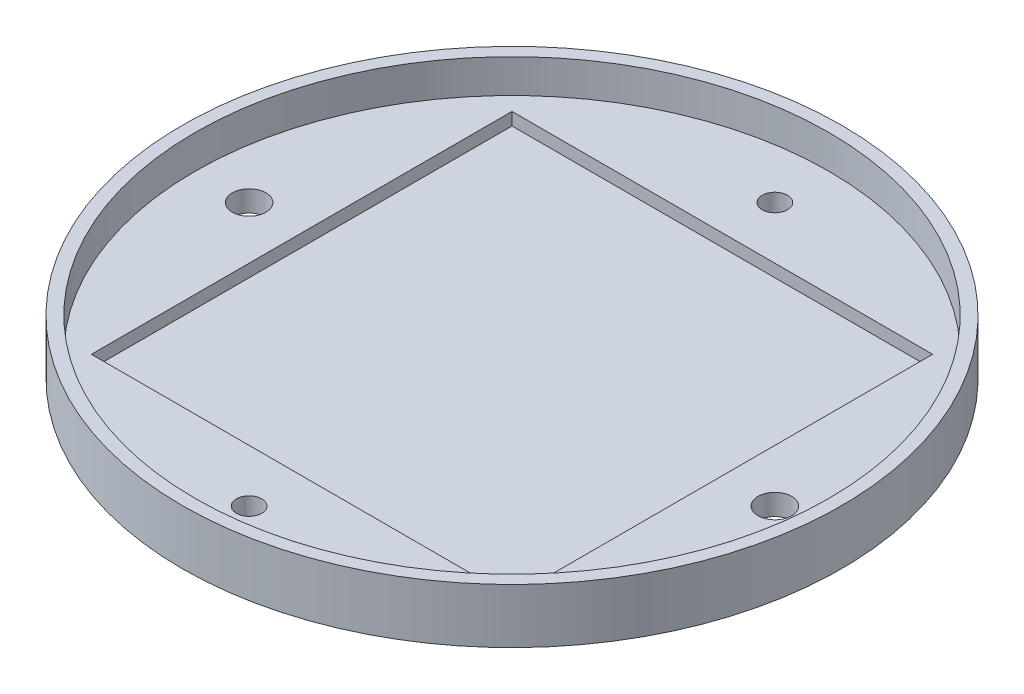
from build123d import *

# Parameters (mm, degrees)
SKETCH1_R           = 78.35
SKETCH1_R_2         = 4
SKETCH1_R_3         = 3
BOSS_EXTRUDE1_DEPTH = 5
SKETCH2_R           = 78.35
SKETCH2_R_2         = 75.35
BOSS_EXTRUDE2_DEPTH = 8
SKETCH3_W           = 100
SKETCH3_H           = 100
CUT_EXTRUDE1_DEPTH  = 3


with BuildPart() as part:
    # Sketch1 → Boss-Extrude1 (new body)
    with BuildSketch(Plane(origin=(0, 0, 0), x_dir=(1, 0, 0), z_dir=(0, 1, 0))):
        with Locations(Location((0, 0, 0), (0, 0, 270))):
            Circle(SKETCH1_R)
        with Locations(Location((-62.5, 0, 0), (0, 0, 270))):
            Circle(SKETCH1_R_2, mode=Mode.SUBTRACT)
        with Locations(Location((62.5, 0, 0), (0, 0, 270))):
            Circle(SKETCH1_R_2, mode=Mode.SUBTRACT)
        with Locations(Location((0, 62.5, 0), (0, 0, 270))):
            Circle(SKETCH1_R_3, mode=Mode.SUBTRACT)
        with Locations(Location((0, -62.5, 0), (0, 0, 270))):
            Circle(SKETCH1_R_3, mode=Mode.SUBTRACT)
    extrude(amount=BOSS_EXTRUDE1_DEPTH)

    # Sketch2 → Boss-Extrude2 (add)
    with BuildSketch(Plane(origin=(0, 5, 0), x_dir=(1, 0, 0), z_dir=(0, 1, 0))):
        with Locations(Location((0, 0, 0), (0, 0, 270))):
            Circle(SKETCH2_R)
        with Locations(Location((0, 0, 0), (0, 0, 270))):
            Circle(SKETCH2_R_2, mode=Mode.SUBTRACT)
    extrude(amount=BOSS_EXTRUDE2_DEPTH)

    # Sketch3 → Cut-Extrude1 (cut)
    with BuildSketch(Plane(origin=(0, 5, 0), x_dir=(1, 0, 0), z_dir=(0, 1, 0))):
        Rectangle(SKETCH3_W, SKETCH3_H)
    extrude(amount=-CUT_EXTRUDE1_DEPTH, mode=Mode.SUBTRACT)


solid = part.part
